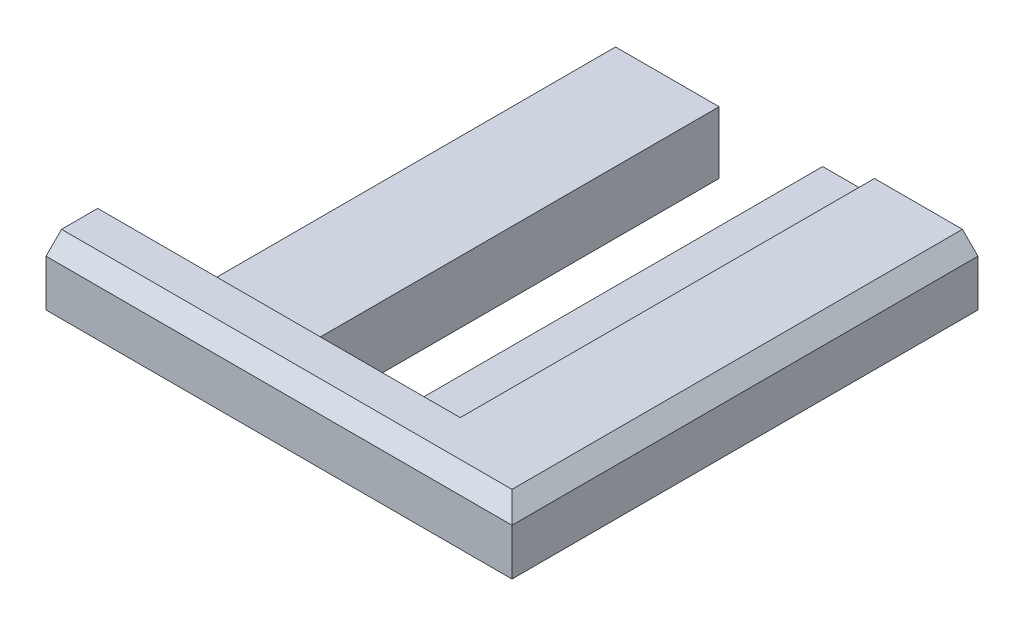
from build123d import *

# Parameters (mm, degrees)
SKETCH1_W           = 50.8
SKETCH1_H           = 203.2
BOSS_EXTRUDE1_DEPTH = 38.1
SKETCH3_R           = 9.525
CUT_EXTRUDE1_DEPTH  = 38.1
SKETCH4_R           = 9.525
CUT_EXTRUDE2_DEPTH  = 38.1
CUT_EXTRUDE3_DEPTH  = 7.62
CHAMFER1_SIZE       = 7.62


with BuildPart() as part:
    # Sketch1 → Boss-Extrude1 (new body)
    with BuildSketch(Plane(origin=(0, 0, 0), x_dir=(1, 0, 0), z_dir=(0, 1, 0))):
        Polygon((-25.4, 228.6), (-25.4, 25.4), (-76.2, 25.4), (-127, 25.4), (-177.8, 25.4), (-228.6, 25.4), (-228.6, 0), (0, 0), (0, 228.6), align=None)
        with Locations((-50.8, 127)):
            Rectangle(SKETCH1_W, SKETCH1_H)
        with Locations((-152.4, 127)):
            Rectangle(SKETCH1_W, SKETCH1_H)
    extrude(amount=BOSS_EXTRUDE1_DEPTH)

    # Sketch3 → Cut-Extrude1 (cut)
    with BuildSketch(Plane.ZY.offset(228.6)):
        with Locations((-12.7, 19.05)):
            Circle(SKETCH3_R)
    extrude(amount=-CUT_EXTRUDE1_DEPTH, mode=Mode.SUBTRACT)

    # Sketch4 → Cut-Extrude2 (cut)
    with BuildSketch(Plane(origin=(0, 0, -228.6), x_dir=(-1, 0, 0), z_dir=(0, 0, -1))):
        with Locations((12.684892179, 19.05)):
            Circle(SKETCH4_R)
    extrude(amount=-CUT_EXTRUDE2_DEPTH, mode=Mode.SUBTRACT)

    # Sketch5 → Cut-Extrude3 (cut)
    with BuildSketch(Plane(origin=(0, 38.1, 0), x_dir=(1, 0, 0), z_dir=(0, 1, 0))):
        Polygon((-50.8, 25.4), (-279.4, 25.371028997), (-279.4, 279.4), (-50.8, 279.4), align=None)
    extrude(amount=-CUT_EXTRUDE3_DEPTH, mode=Mode.SUBTRACT)

    # Chamfer1
    chamfer1_edges = [part.edges().sort_by_distance(p)[0] for p in [
        (0, 0, -114.3),
        (-114.3, 0, 0),
        (-114.3, 38.1, 0),
        (0, 38.1, -114.3),
    ]]
    chamfer(chamfer1_edges, length=CHAMFER1_SIZE)


solid = part.part
